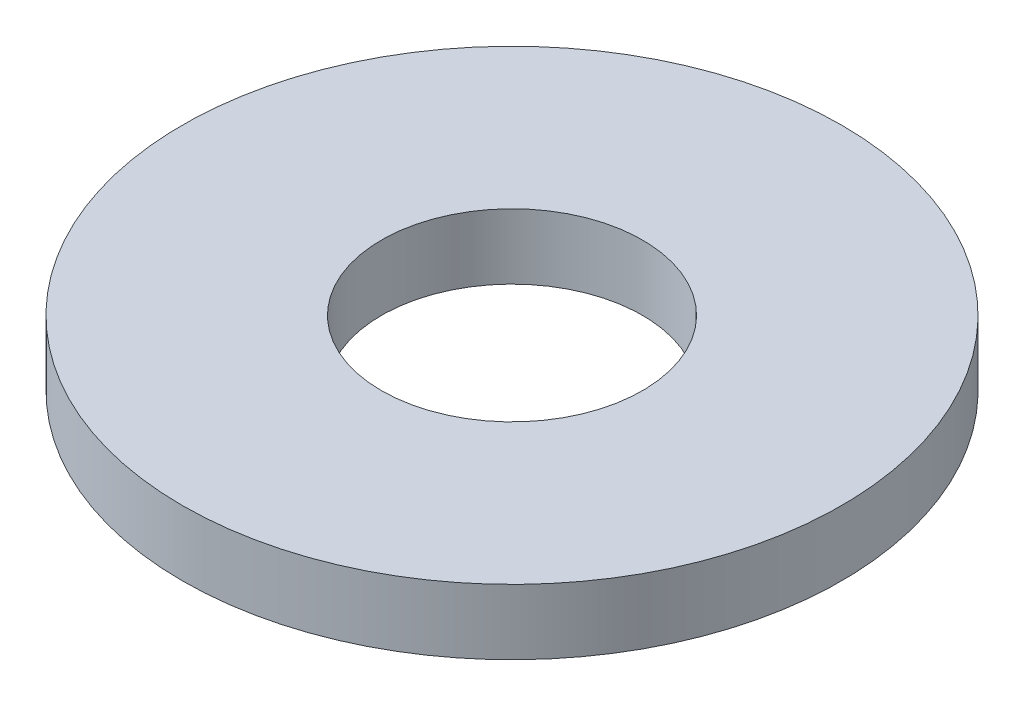
from build123d import *

# Parameters (mm, degrees)
SKETCH_1_R      = 5.05
SKETCH_1_R_2    = 2
EXTRUDE_1_DEPTH = 1


with BuildPart() as part:
    # ｽｹｯﾁ1 → 押し出し1 (new body)
    with BuildSketch(Plane(origin=(0, 0, 0), x_dir=(1, 0, 0), z_dir=(0, 1, 0))):
        with Locations(Location((0, 0, 0), (0, 0, 270))):
            Circle(SKETCH_1_R)
        with Locations(Location((0, 0, 0), (0, 0, 270))):
            Circle(SKETCH_1_R_2, mode=Mode.SUBTRACT)
    extrude(amount=EXTRUDE_1_DEPTH)


solid = part.part
